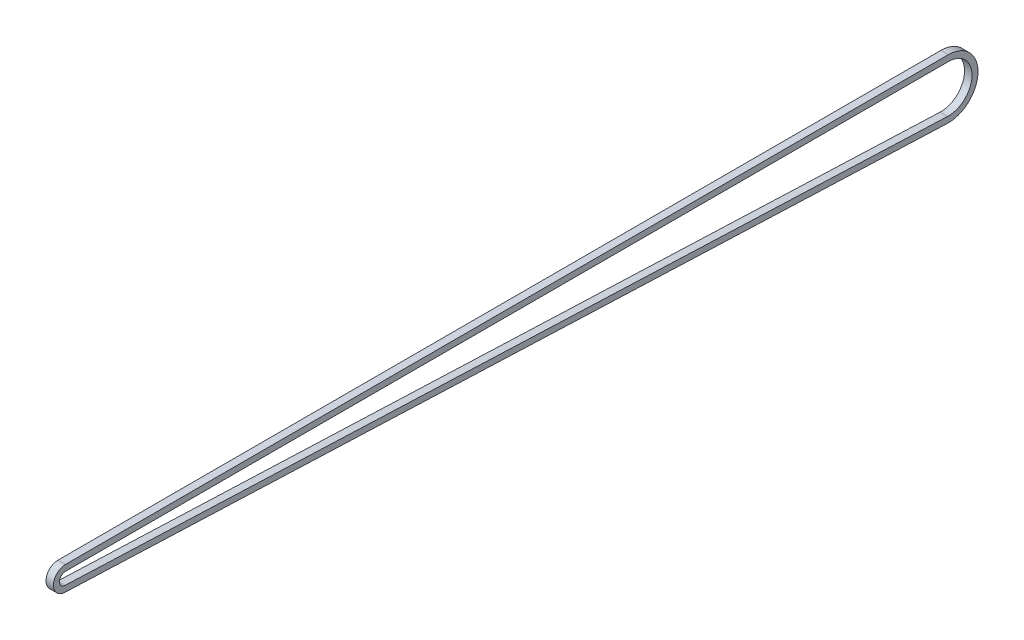
from build123d import *

# Parameters (mm, degrees)
EXTRUDE_1_DEPTH = 5


with BuildPart() as part:
    # ｽｹｯﾁ1 → ﾎﾞｽ - 押し出し1 (new body)
    with BuildSketch(Plane(origin=(0, 0, 0), x_dir=(0, 0, -1), z_dir=(1, 0, 0))):
        with BuildLine():
            Line((590.5, 8), (0, 8))
            ThreePointArc((0, 8), (-7.998416686, 0.159155624), (-0.31824825, -7.993667372))
            Line((-0.31824825, -7.993667372), (589.714324633, -31.484366324))
            ThreePointArc((589.714324633, -31.484366324), (610.246091194, -12.142915447), (590.5, 8))
        make_face()
        with BuildLine():
            ThreePointArc((-0.159124125, -3.996833686), (-3.999208343, 0.079577812), (0, 4))
            Line((0, 4), (590.5, 4))
            ThreePointArc((590.5, 4), (601.636931804, -0.613068196), (606.25, -11.75))
            ThreePointArc((606.25, -11.75), (601.41316448, -23.106290813), (589.873448758, -27.487532638))
            Line((589.873448758, -27.487532638), (-0.159124125, -3.996833686))
        make_face(mode=Mode.SUBTRACT)
    extrude(amount=EXTRUDE_1_DEPTH)


solid = part.part
